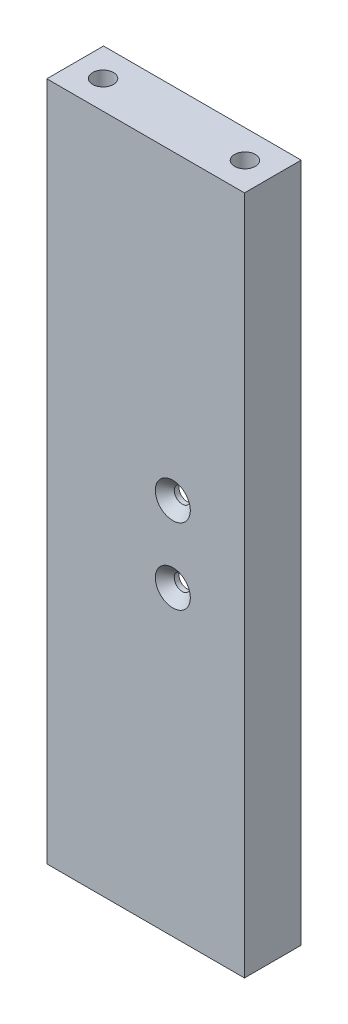
from build123d import *

# Parameters (mm, degrees)
SKETCH1_W                 = 41.8
SKETCH1_H                 = 143.8
BOSS_EXTRUDE1_DEPTH       = 12
SHELL1_T                  = -7
SHELL1_THICKNESS_2_FACE_W = 27.8
SHELL1_THICKNESS_2_FACE_H = 129.8
SHELL1_THICKNESS_2_DEPTH  = 4
SKETCH2_R                 = 2.2
CUT_EXTRUDE1_DEPTH        = 5.2
SKETCH3_R                 = 2.2
CUT_EXTRUDE2_DEPTH        = 5.2
SKETCH5_R                 = 1.7
CUT_EXTRUDE3_DEPTH        = 10
CHAMFER1_SIZE             = 2


with BuildPart() as part:
    # Sketch1 → Boss-Extrude1 (new body)
    with BuildSketch(Plane.XY):
        with Locations((0, 71.9)):
            Rectangle(SKETCH1_W, SKETCH1_H)
    extrude(amount=-BOSS_EXTRUDE1_DEPTH)

    # Shell1
    shell1_openings = [part.faces().sort_by_distance(p)[0] for p in [
        (0, 71.9, -12),
    ]]
    offset(amount=SHELL1_T, openings=shell1_openings, kind=Kind.INTERSECTION)

    # Shell1 thickness 2 face (on inner face of the shell) → Shell1 thickness 2 (cut)
    with BuildSketch(Plane(origin=(0, 71.9, -7), x_dir=(1, 0, 0), z_dir=(0, 0, 1))):
        Rectangle(SHELL1_THICKNESS_2_FACE_W, SHELL1_THICKNESS_2_FACE_H)
    extrude(amount=SHELL1_THICKNESS_2_DEPTH, mode=Mode.SUBTRACT)

    # Sketch2 → Cut-Extrude1 (cut)
    with BuildSketch(Plane(origin=(0, 143.8, 0), x_dir=(1, 0, 0), z_dir=(0, 1, 0))):
        with Locations(Location((-15, 6, 0), (0, 0, 270))):
            Circle(SKETCH2_R)
        with Locations(Location((15, 6, 0), (0, 0, 270))):
            Circle(SKETCH2_R)
    cut_extrude1 = extrude(amount=-CUT_EXTRUDE1_DEPTH, mode=Mode.SUBTRACT)

    # Mirror1: Cut-Extrude1 across plane
    add(cut_extrude1.mirror(Plane.ZX.offset(71.9)), mode=Mode.SUBTRACT)

    # Sketch3 → Cut-Extrude2 (cut)
    with BuildSketch(Plane.ZY.offset(20.9)):
        with Locations((-6, 129.4)):
            Circle(SKETCH3_R)
        with Locations((-6, 14.4)):
            Circle(SKETCH3_R)
    extrude(amount=-CUT_EXTRUDE2_DEPTH, mode=Mode.SUBTRACT)

    # Sketch5 → Cut-Extrude3 (cut)
    with BuildSketch(Plane(origin=(0, 0, -3), x_dir=(-1, 0, 0), z_dir=(0, 0, -1))):
        with Locations((-5.75, 63.9)):
            Circle(SKETCH5_R)
        with Locations((-5.75, 79.9)):
            Circle(SKETCH5_R)
    extrude(amount=-CUT_EXTRUDE3_DEPTH, mode=Mode.SUBTRACT)

    # Chamfer1
    chamfer1_edges = [part.edges().sort_by_distance(p)[0] for p in [
        (7.45, 63.9, 0),
        (7.45, 79.9, 0),
    ]]
    chamfer(chamfer1_edges, length=CHAMFER1_SIZE)


solid = part.part
